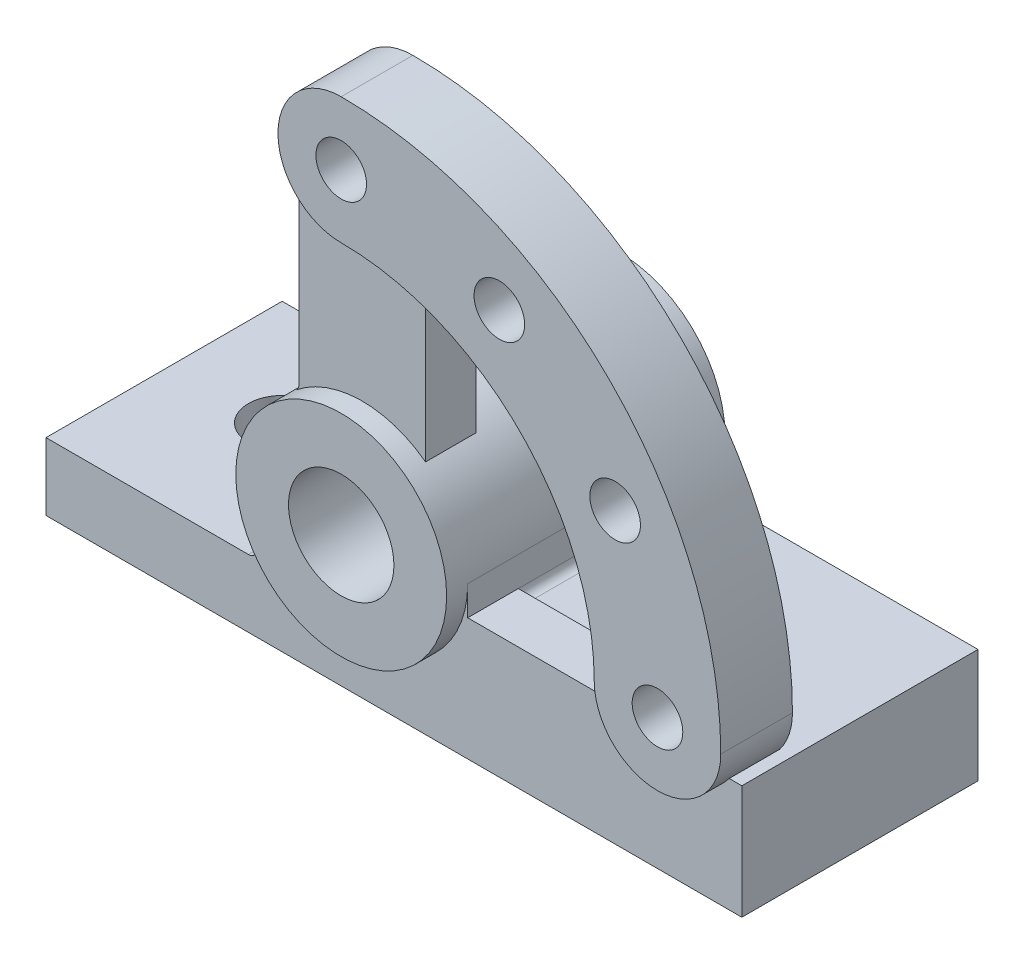
from build123d import *

# Parameters (mm, degrees)
SKETCH10_R           = 25
SKETCH10_R_2         = 12.5
BOSS_EXTRUDE7_DEPTH  = 33
BOSS_EXTRUDE9_START  = 5
BOSS_EXTRUDE9_DEPTH  = 56
SKETCH13_R           = 8
CUT_EXTRUDE1_DEPTH   = 16
BOSS_EXTRUDE12_DEPTH = 17
SKETCH17_R           = 6
CUT_EXTRUDE2_DEPTH   = 17
BOSS_EXTRUDE13_DEPTH = 12
SKETCH20_R           = 8
CUT_EXTRUDE3_DEPTH   = 27
FILLET1_R            = 2


with BuildPart() as part:
    # Sketch10 → Boss-Extrude7 (new, symmetric)
    with BuildSketch(Plane.XY):
        Circle(SKETCH10_R)
        Circle(SKETCH10_R_2, mode=Mode.SUBTRACT)
    extrude(amount=BOSS_EXTRUDE7_DEPTH, both=True)



with BuildPart() as body_2:
    # Sketch12 → Boss-Extrude9 (new body)
    with BuildSketch(Plane(origin=(0, 0, 33), x_dir=(-1, 0, 0), z_dir=(0, 0, -1)).offset(BOSS_EXTRUDE9_START)):
        with BuildLine():
            Line((0, -36), (75, -36))
            Line((75, -36), (75, -20))
            Line((75, -20), (27, -20))
            ThreePointArc((27, -20), (25.585786438, -19.414213562), (25, -18))
            Line((25, -18), (25, 0))
            ThreePointArc((25, 0), (0, -25), (-25, 0))
            Line((-25, 0), (-25, -7))
            ThreePointArc((-25, -7), (-25.585786438, -8.414213562), (-27, -9))
            Line((-27, -9), (-90, -9))
            Line((-90, -9), (-90, -36))
            Line((-90, -36), (0, -36))
        make_face()
    extrude(amount=BOSS_EXTRUDE9_DEPTH)

    # Sketch13 → Cut-Extrude1 (cut)
    with BuildSketch(Plane(origin=(0, -20, 0), x_dir=(1, 0, 0), z_dir=(0, 1, 0))):
        with Locations(Location((-50, 3, 0), (0, 0, 270))):
            Circle(SKETCH13_R)
    extrude(amount=-CUT_EXTRUDE1_DEPTH, mode=Mode.SUBTRACT)


with BuildPart() as body_3:
    # Sketch15 → Boss-Extrude12 (new body)
    with BuildSketch(Plane.XY.offset(33)):
        with BuildLine():
            ThreePointArc((60, 0), (42.426406871, 42.426406871), (0, 60))
            ThreePointArc((0, 60), (-15, 75), (0, 90))
            ThreePointArc((0, 90), (63.639610307, 63.639610307), (90, 0))
            ThreePointArc((90, 0), (75, -15), (60, 0))
        make_face()
    extrude(amount=-BOSS_EXTRUDE12_DEPTH)

    # Sketch17 → Cut-Extrude2 (cut)
    with BuildSketch(Plane.XY.offset(33)):
        with Locations((0, 75)):
            Circle(SKETCH17_R)
        with Locations((37.5, 64.951905284)):
            Circle(SKETCH17_R)
        with Locations((64.951905284, 37.5)):
            Circle(SKETCH17_R)
        with Locations((75, 0)):
            Circle(SKETCH17_R)
    extrude(amount=-CUT_EXTRUDE2_DEPTH, mode=Mode.SUBTRACT)


with BuildPart() as part_1:
    add(part.part)

    add(body_2.part)  # Boss-Extrude13 merges body 2

    add(body_3.part)  # Boss-Extrude13 merges body 3
    # Sketch18 → Boss-Extrude13 (add)
    with BuildSketch(Plane.XY.offset(28)):
        with BuildLine():
            Line((25, -7), (58, -7))
            ThreePointArc((58, -7), (59.414213562, -6.414213562), (60, -5))
            Line((60, -5), (60, 0))
            ThreePointArc((60, 0), (60.769750529, -4.74341649), (63, -9))
            Line((63, -9), (27, -9))
            ThreePointArc((27, -9), (25.585786438, -8.414213562), (25, -7))
        make_face()
        with BuildLine():
            Line((-15, 75), (-15, 20))
            ThreePointArc((-15, 20), (0, 25), (15, 20))
            Line((15, 20), (15, 58.094750193))
            ThreePointArc((15, 58.094750193), (7.560257549, 59.521781776), (0, 60))
            ThreePointArc((0, 60), (-10.606601718, 64.393398282), (-15, 75))
        make_face()
    extrude(amount=-BOSS_EXTRUDE13_DEPTH)

    # Sketch20 → Cut-Extrude3 (cut)
    with BuildSketch(Plane(origin=(0, -9, 0), x_dir=(1, 0, 0), z_dir=(0, 1, 0))):
        with Locations(Location((57.5, 3, 0), (0, 0, 270))):
            Circle(SKETCH20_R)
    extrude(amount=-CUT_EXTRUDE3_DEPTH, mode=Mode.SUBTRACT)

    # Fillet1
    fillet1_edges = [part_1.edges().sort_by_distance(p)[0] for p in [
        (-15, 20, 22),
    ]]
    fillet(fillet1_edges, radius=FILLET1_R)


solid = part_1.part
